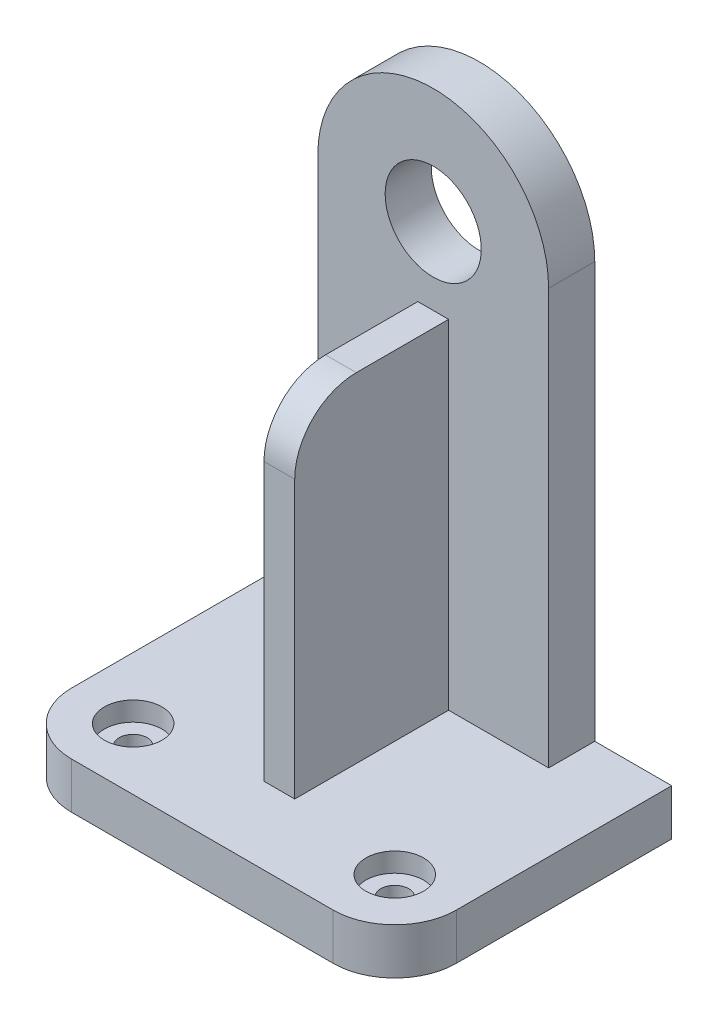
from build123d import *

# Parameters (mm, degrees)
EXTRUDE_1_DEPTH     = 12
SKETCH_1_3_R        = 3.63567385
CUT_EXTRUDE_1_DEPTH = 12
SKETCH_2_R          = 7.5
CUT_EXTRUDE_2_DEPTH = 5
SKETCH_4_R          = 12.5
EXTRUDE_2_DEPTH     = 12
SKETCH_5_W          = 40
SKETCH_5_H          = 88
EXTRUDE_3_DEPTH     = 4
FILLET_1_R          = 16


with BuildPart() as part:
    # 草图1 → 凸台-拉伸1 (new body)
    with BuildSketch(Plane(origin=(0, 0, 0), x_dir=(1, 0, 0), z_dir=(0, 1, 0))):
        with BuildLine():
            Line((-50, 36), (50, 36))
            Line((50, 36), (50, -20))
            ThreePointArc((50, -20), (45.313708499, -31.313708499), (34, -36))
            Line((34, -36), (-34, -36))
            ThreePointArc((-34, -36), (-45.313708499, -31.313708499), (-50, -20))
            Line((-50, -20), (-50, 36))
        make_face()
    extrude(amount=EXTRUDE_1_DEPTH)

    # 草图1<3> → 切除-拉伸1 (cut)
    with BuildSketch(Plane(origin=(0, 0, 0), x_dir=(1, 0, 0), z_dir=(0, 1, 0))):
        with Locations((-34, -20)):
            Circle(SKETCH_1_3_R)
        with Locations((34, -20)):
            Circle(SKETCH_1_3_R)
    extrude(amount=CUT_EXTRUDE_1_DEPTH, mode=Mode.SUBTRACT)

    # 草图2 → 切除-拉伸2 (cut)
    with BuildSketch(Plane(origin=(0, 12, 0), x_dir=(1, 0, 0), z_dir=(0, 1, 0))):
        with Locations((34, -20)):
            Circle(SKETCH_2_R)
        with Locations((-34, -20)):
            Circle(SKETCH_2_R)
    extrude(amount=-CUT_EXTRUDE_2_DEPTH, mode=Mode.SUBTRACT)

    # 草图4 → 凸台-拉伸2 (add)
    with BuildSketch(Plane(origin=(0, 0, -36), x_dir=(-1, 0, 0), z_dir=(0, 0, -1))):
        with BuildLine():
            Line((-30, 12), (30, 12))
            Line((30, 12), (30, 120))
            ThreePointArc((30, 120), (0, 150), (-30, 120))
            Line((-30, 120), (-30, 12))
        make_face()
        with Locations((0, 120)):
            Circle(SKETCH_4_R, mode=Mode.SUBTRACT)
    extrude(amount=-EXTRUDE_2_DEPTH)

    # 草图5 → 凸台-拉伸3 (add, symmetric)
    with BuildSketch(Plane(origin=(0, 0, 0), x_dir=(0, 0, -1), z_dir=(1, 0, 0))):
        with Locations((4, 56)):
            Rectangle(SKETCH_5_W, SKETCH_5_H)
    extrude(amount=EXTRUDE_3_DEPTH, both=True)

    # 圆角1
    fillet_1_edges = [part.edges().sort_by_distance(p)[0] for p in [
        (0, 100, 16),
    ]]
    fillet(fillet_1_edges, radius=FILLET_1_R)


solid = part.part
